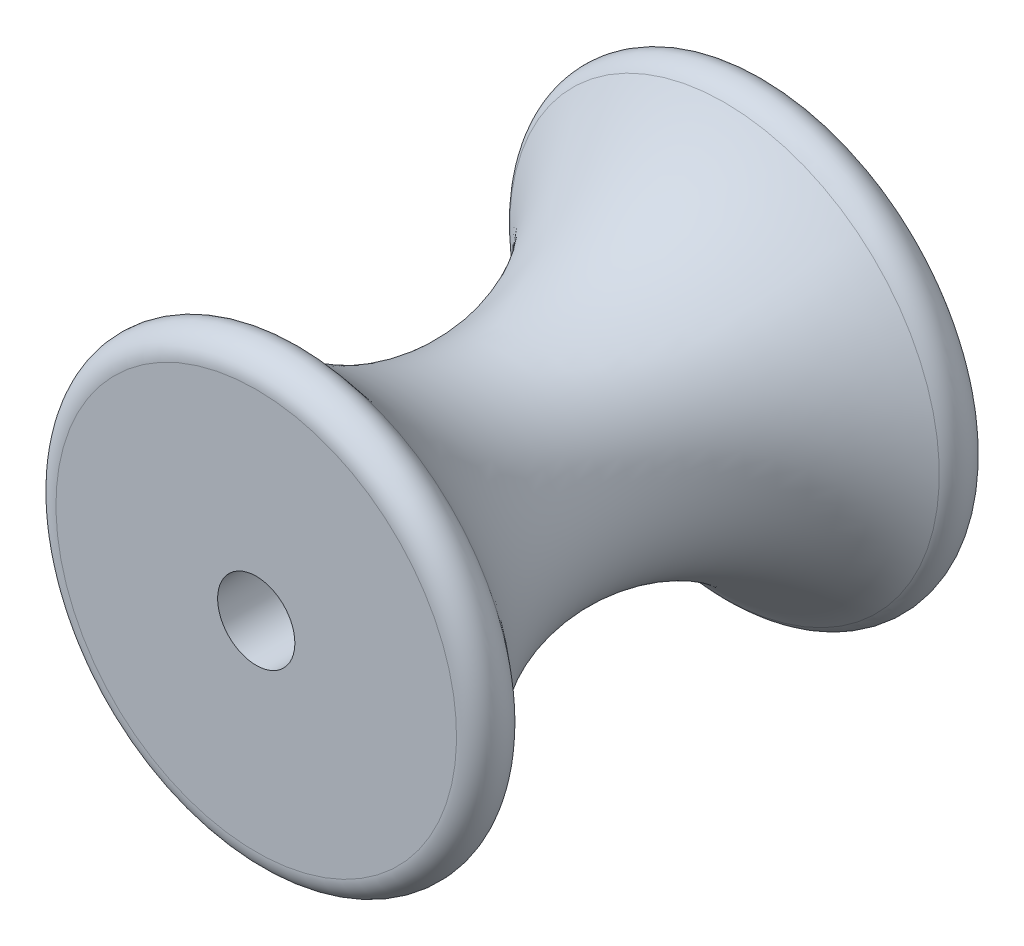
from build123d import *

# Parameters (mm, degrees)
FILLET1_R = 1


with BuildPart() as part:
    # Sketch1 → Revolve1 (revolve)
    with BuildSketch(Plane(origin=(0, 0, 0), x_dir=(0, 0, -1), z_dir=(1, 0, 0))):
        with BuildLine():
            Line((10.6, 1.6), (10.6, 12.560612309))
            ThreePointArc((10.6, 12.560612309), (0, 4.5), (-10.6, 12.560612309))
            Line((-10.6, 12.560612309), (-10.6, 1.6))
            Line((-10.6, 1.6), (10.6, 1.6))
        make_face()
    revolve(axis=Axis((0, 0, -11), (0, 0, 1)))

    # Fillet1
    fillet1_edges = [part.edges().sort_by_distance(p)[0] for p in [
        (0, -12.560612309, 10.6),
        (0, -12.560612309, -10.6),
    ]]
    fillet(fillet1_edges, radius=FILLET1_R)


solid = part.part
